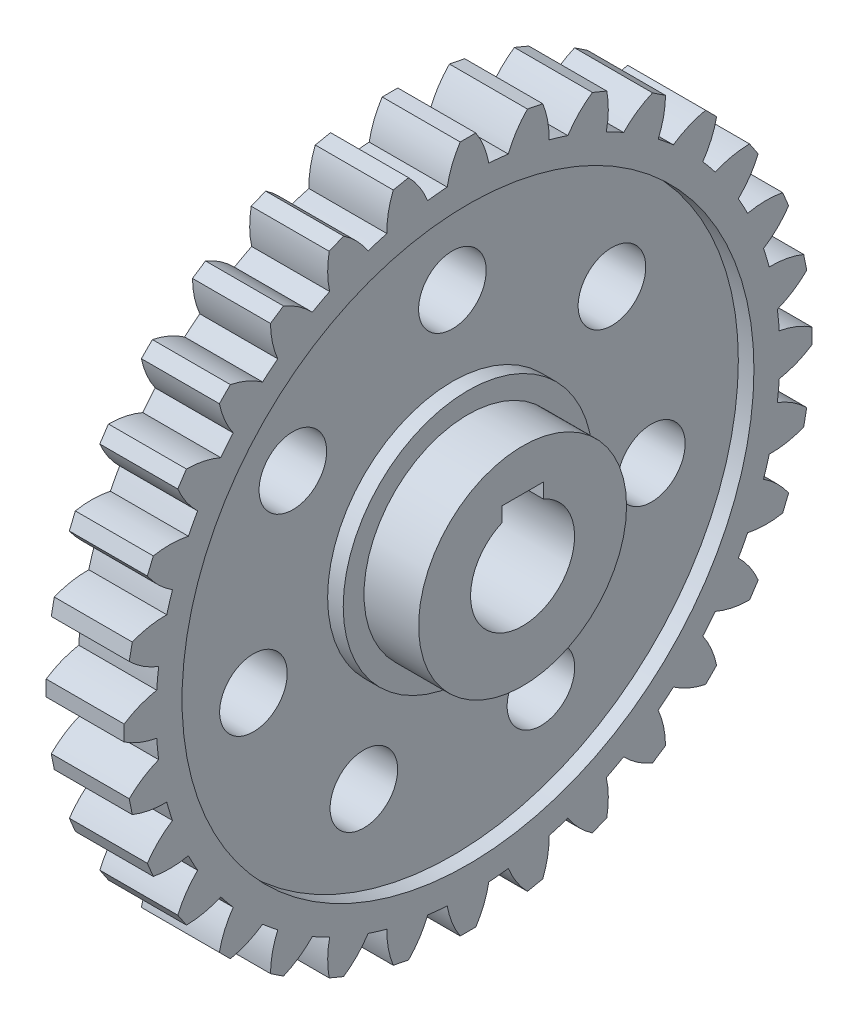
from build123d import *

# Parameters (mm, degrees)
SKETCH2_R           = 60
BOSS_EXTRUDE1_DEPTH = 7.5
BOSS_EXTRUDE2_DEPTH = 15
CIRPATTERN1_COUNT   = 32
SKETCH5_R           = 20
BOSS_EXTRUDE4_DEPTH = 18
CUT_EXTRUDE1_DEPTH  = 101.216188592
SKETCH7_R           = 55
SKETCH7_R_2         = 24
CUT_EXTRUDE2_DEPTH  = 3
SKETCH8_R           = 6.5
CUT_EXTRUDE3_DEPTH  = 97.195293315


with BuildPart() as part:
    # Sketch2 → Boss-Extrude1 (new, symmetric)
    with BuildSketch(Plane(origin=(0, 0, 0), x_dir=(0, 0, -1), z_dir=(1, 0, 0))):
        Circle(SKETCH2_R)
    extrude(amount=BOSS_EXTRUDE1_DEPTH, both=True)

    # Sketch3 → Boss-Extrude2 (add)
    with BuildSketch(Plane(origin=(7.5, 0, 0), x_dir=(0, 0, -1), z_dir=(1, 0, 0))):
        with BuildLine():
            Line((-1.5, 66.133518188), (1.5, 66.133518188))
            ThreePointArc((1.5, 66.133518188), (3.064041848, 63.125294177), (4, 59.866518188))
            ThreePointArc((4, 59.866518188), (0, 60), (-4, 59.866518188))
            ThreePointArc((-4, 59.866518188), (-3.064041848, 63.125294177), (-1.5, 66.133518188))
        make_face()
    boss_extrude2 = extrude(amount=-BOSS_EXTRUDE2_DEPTH)

    # CirPattern1: Boss-Extrude2 ×32 about axis
    cirpattern1_axis = Axis((0, 0, 0), (1, 0, 0))
    for i in range(1, CIRPATTERN1_COUNT):
        add(boss_extrude2.rotate(cirpattern1_axis, i * 360 / CIRPATTERN1_COUNT))

    # Sketch5 → Boss-Extrude4 (add, symmetric)
    with BuildSketch(Plane(origin=(0, 0, 0), x_dir=(0, 0, -1), z_dir=(1, 0, 0))):
        Circle(SKETCH5_R)
    extrude(amount=BOSS_EXTRUDE4_DEPTH, both=True)

    # Sketch6 → Cut-Extrude1 (cut, through all)
    with BuildSketch(Plane(origin=(18, 0, 0), x_dir=(0, 0, -1), z_dir=(1, 0, 0))):
        with BuildLine():
            Line((-4, 12), (4, 12))
            Line((4, 12), (4, 9.16515139))
            ThreePointArc((4, 9.16515139), (0, -10), (-4, 9.16515139))
            Line((-4, 9.16515139), (-4, 12))
        make_face()
    extrude(amount=-CUT_EXTRUDE1_DEPTH, mode=Mode.SUBTRACT)

    # Sketch7 → Cut-Extrude2 (cut)
    with BuildSketch(Plane(origin=(7.5, 0, 0), x_dir=(0, 0, -1), z_dir=(1, 0, 0))):
        Circle(SKETCH7_R)
        Circle(SKETCH7_R_2, mode=Mode.SUBTRACT)
    extrude(amount=-CUT_EXTRUDE2_DEPTH, mode=Mode.SUBTRACT)

    # Sketch8 → Cut-Extrude3 (cut, through all)
    with BuildSketch(Plane(origin=(4.5, 0, 0), x_dir=(0, 0, -1), z_dir=(1, 0, 0))):
        with Locations((0, 39.25)):
            Circle(SKETCH8_R)
        with Locations((30.686885687, 24.471974723)):
            Circle(SKETCH8_R)
        with Locations((38.265920553, -8.733946658)):
            Circle(SKETCH8_R)
        with Locations((17.02993676, -35.363028065)):
            Circle(SKETCH8_R)
        with Locations((-17.02993676, -35.363028065)):
            Circle(SKETCH8_R)
        with Locations((-38.265920553, -8.733946658)):
            Circle(SKETCH8_R)
        with Locations((-30.686885687, 24.471974723)):
            Circle(SKETCH8_R)
    extrude(amount=-CUT_EXTRUDE3_DEPTH, mode=Mode.SUBTRACT)


solid = part.part
